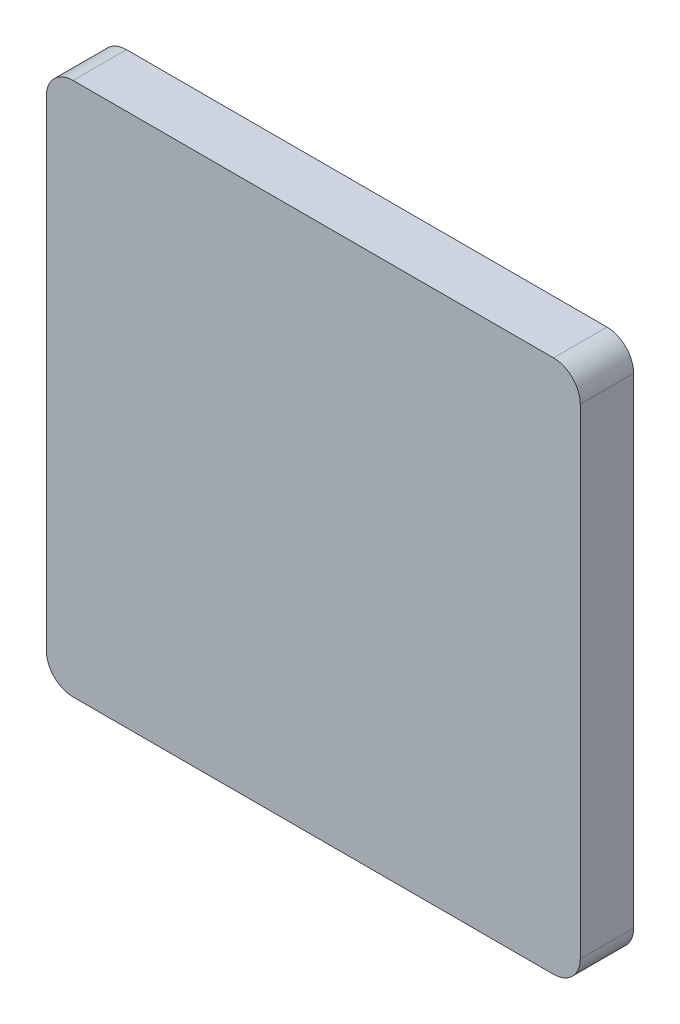
from build123d import *

# Parameters (mm, degrees)
SKETCH1_W           = 20
SKETCH1_H           = 20
BOSS_EXTRUDE1_DEPTH = 2
FILLET1_R           = 1


with BuildPart() as part:
    # Sketch1 → Boss-Extrude1 (new body)
    with BuildSketch(Plane.XY):
        Rectangle(SKETCH1_W, SKETCH1_H)
    extrude(amount=BOSS_EXTRUDE1_DEPTH)

    # Fillet1
    fillet1_edges = [part.edges().sort_by_distance(p)[0] for p in [
        (10, -10, 1),
        (-10, -10, 1),
        (-10, 10, 1),
        (10, 10, 1),
    ]]
    fillet(fillet1_edges, radius=FILLET1_R)


solid = part.part
